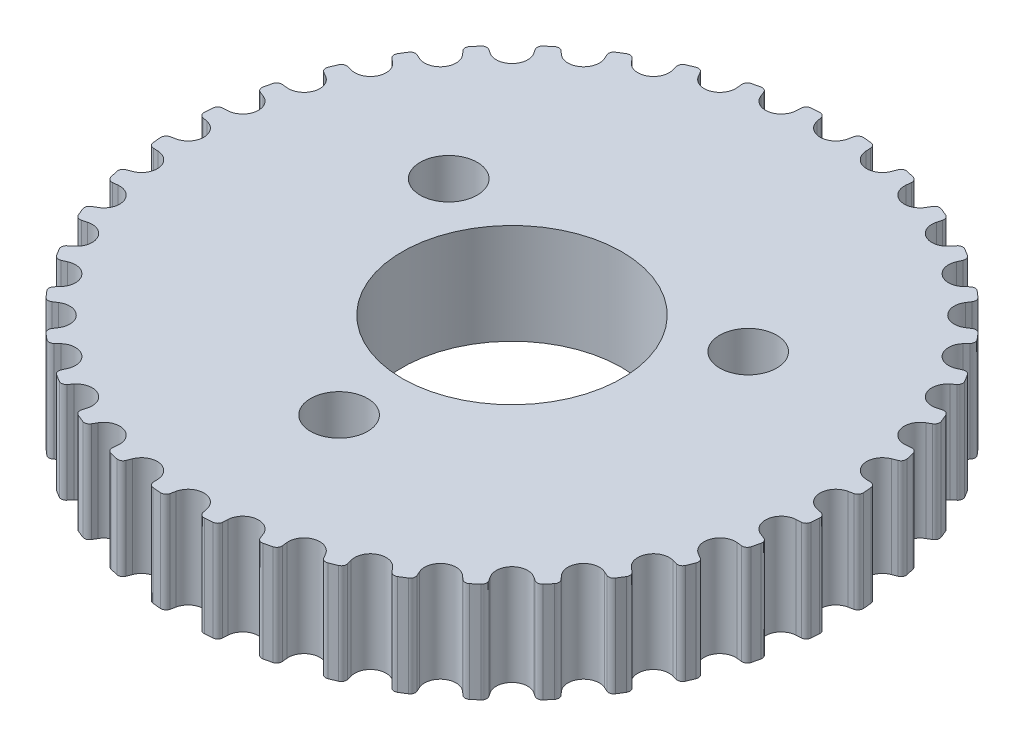
from build123d import *

# Parameters (mm, degrees)
SKETCH1_R           = 19.098593171
BOSS_EXTRUDE1_DEPTH = 5.8
CUT_EXTRUDE1_DEPTH  = 28.625215334
CIRPATTERN1_COUNT   = 40
SKETCH3_R           = 6.35
CUT_EXTRUDE2_DEPTH  = 28.568298151
SKETCH4_R           = 1.65
CUT_EXTRUDE3_DEPTH  = 28.568298151


with BuildPart() as part:
    # Sketch1 → Boss-Extrude1 (new body)
    with BuildSketch(Plane(origin=(0, 0, 0), x_dir=(1, 0, 0), z_dir=(0, 1, 0))):
        with Locations(Location((0, 0, 0), (0, 0, 270))):
            Circle(SKETCH1_R)
    extrude(amount=BOSS_EXTRUDE1_DEPTH)

    # Sketch2 → Cut-Extrude1 (cut, through all)
    with BuildSketch(Plane(origin=(0, 5.8, 0), x_dir=(1, 0, 0), z_dir=(0, 1, 0))):
        with BuildLine():
            Line((-0.889963519, 18.53868547), (-0.95, 18.820034134))
            ThreePointArc((-0.95, 18.820034134), (-1.062511657, 18.996762473), (-1.263237454, 19.056770247))
            ThreePointArc((-1.263237454, 19.056770247), (-2.127654439, 18.979708841), (-2.987678206, 18.863457797))
            Line((-2.987678206, 18.863457797), (-2.987678206, 19.098593171))
            Line((-2.987678206, 19.098593171), (2.987678206, 19.098593171))
            Line((2.987678206, 19.098593171), (2.987678206, 18.863457797))
            ThreePointArc((2.987678206, 18.863457797), (2.127654439, 18.979708841), (1.263237454, 19.056770247))
            ThreePointArc((1.263237454, 19.056770247), (1.062511657, 18.996762473), (0.95, 18.820034134))
            Line((0.95, 18.820034134), (0.889963519, 18.53868547))
            ThreePointArc((0.889963519, 18.53868547), (0, 17.818593171), (-0.889963519, 18.53868547))
        make_face()
    cut_extrude1 = extrude(amount=-CUT_EXTRUDE1_DEPTH, mode=Mode.SUBTRACT)

    # CirPattern1: Cut-Extrude1 ×40 about axis
    cirpattern1_axis = Axis((0, 0, 0), (0, 1, 0))
    for i in range(1, CIRPATTERN1_COUNT):
        add(cut_extrude1.rotate(cirpattern1_axis, i * 360 / CIRPATTERN1_COUNT), mode=Mode.SUBTRACT)

    # Sketch3 → Cut-Extrude2 (cut, through all)
    with BuildSketch(Plane.XZ):
        with Locations(Location((0, 0, 0), (0, 0, 270))):
            Circle(SKETCH3_R)
    extrude(amount=-CUT_EXTRUDE2_DEPTH, mode=Mode.SUBTRACT)

    # Sketch4 → Cut-Extrude3 (cut, through all)
    with BuildSketch(Plane.XZ):
        with Locations(Location((0, 10, 0), (0, 0, 270))):
            Circle(SKETCH4_R)
        with Locations(Location((8.660254038, -5, 0), (0, 0, 270))):
            Circle(SKETCH4_R)
        with Locations(Location((-8.660254038, -5, 0), (0, 0, 270))):
            Circle(SKETCH4_R)
    extrude(amount=-CUT_EXTRUDE3_DEPTH, mode=Mode.SUBTRACT)


solid = part.part
